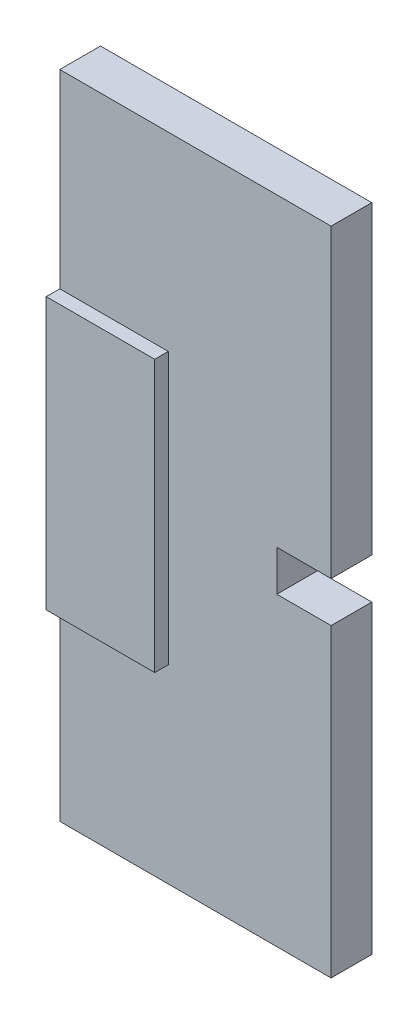
from build123d import *

# Parameters (mm, degrees)
BOSS_EXTRUDE3_DEPTH = 4.7625
BOSS_EXTRUDE5_DEPTH = 1.5875
SKETCH12_W          = 6.35
SKETCH12_H          = 35.71875
CUT_EXTRUDE1_DEPTH  = 9.652


with BuildPart() as part:
    # Sketch1 → Boss-Extrude3 (new body)
    with BuildSketch(Plane.XY):
        Polygon((43.795067265, 15.433632287), (5.695067265, 15.433632287), (5.695067265, -60.766367713), (43.795067265, -60.766367713), (43.795067265, -25.047617713), (31.095067265, -25.047617713), (31.095067265, -20.285117713), (43.795067265, -20.285117713), align=None)
    extrude(amount=BOSS_EXTRUDE3_DEPTH)

    # Sketch3 → Boss-Extrude5 (add)
    with BuildSketch(Plane.XY.offset(4.7625)):
        Polygon((18.395067265, -6.791367713), (5.695067265, -6.791367713), (5.695067265, -22.666367713), (5.695067265, -38.541367713), (18.395067265, -38.541367713), align=None)
    extrude(amount=BOSS_EXTRUDE5_DEPTH)

    # Sketch12 → Cut-Extrude1 (cut)
    with BuildSketch(Plane.XY.offset(4.7625)):
        with Locations((40.620067265, -42.906992713)):
            Rectangle(SKETCH12_W, SKETCH12_H)
        with Locations((40.620067265, -2.425742713)):
            Rectangle(SKETCH12_W, SKETCH12_H)
    extrude(amount=-CUT_EXTRUDE1_DEPTH, mode=Mode.SUBTRACT)


solid = part.part
